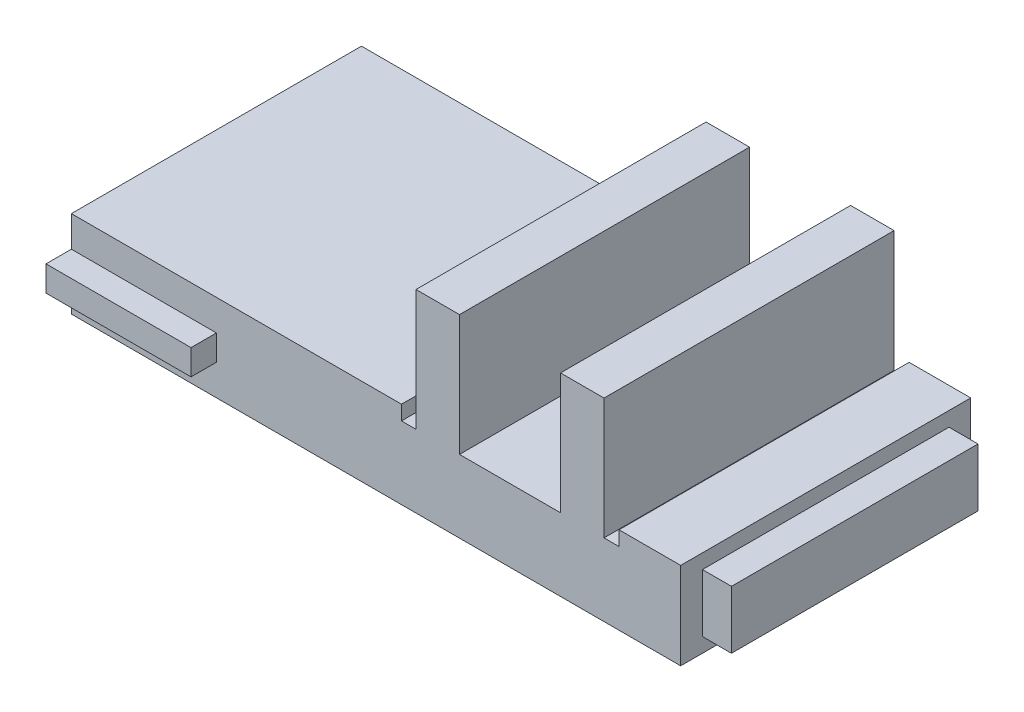
from build123d import *

# Parameters (mm, degrees)
BOSS_EXTRUDE1_DEPTH = 20
SKETCH6_W           = 17
SKETCH6_H           = 4
BOSS_EXTRUDE3_DEPTH = 2
SKETCH7_W           = 3
SKETCH7_H           = 20
BOSS_EXTRUDE4_DEPTH = 8.35
SKETCH8_W           = 1.75
SKETCH8_H           = 1.75
BOSS_EXTRUDE5_DEPTH = 10


with BuildPart() as part:
    # Sketch2 → Boss-Extrude1 (new body)
    with BuildSketch(Plane.XY):
        Polygon((-7.5, 1), (-30.26, 1), (-30.26, -5), (11.75, -5), (11.75, 1), (7.5, 1), (7.5, 0), (-7.5, 0), align=None)
    extrude(amount=BOSS_EXTRUDE1_DEPTH)

    # Sketch6 → Boss-Extrude3 (add)
    with BuildSketch(Plane(origin=(11.75, 0, 0), x_dir=(0, 0, -1), z_dir=(1, 0, 0))):
        with Locations((-10, -2)):
            Rectangle(SKETCH6_W, SKETCH6_H)
    extrude(amount=BOSS_EXTRUDE3_DEPTH)

    # Sketch7 → Boss-Extrude4 (add)
    with BuildSketch(Plane(origin=(0, 0, 0), x_dir=(1, 0, 0), z_dir=(0, 1, 0))):
        with Locations((-5, -10)):
            Rectangle(SKETCH7_W, SKETCH7_H)
        with Locations((4.965868183, -10)):
            Rectangle(SKETCH7_W, SKETCH7_H)
    extrude(amount=BOSS_EXTRUDE4_DEPTH)

    # Sketch8 → Boss-Extrude5 (add)
    with BuildSketch(Plane.ZY.offset(30.26)):
        with Locations((-0.875, -2)):
            Rectangle(SKETCH8_W, SKETCH8_H)
        with Locations((20.875, -2)):
            Rectangle(SKETCH8_W, SKETCH8_H)
    extrude(amount=-BOSS_EXTRUDE5_DEPTH)


solid = part.part
